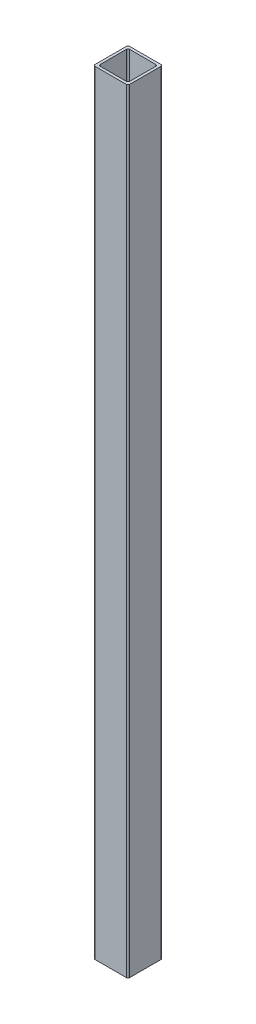
from build123d import *

# Parameters (mm, degrees)
BOSS_EXTRUDE1_DEPTH = 447.59


with BuildPart() as part:
    # Sketch1 → Boss-Extrude1 (new body)
    with BuildSketch(Plane(origin=(0, 0, 0), x_dir=(1, 0, 0), z_dir=(0, 1, 0))):
        with BuildLine():
            Line((-9, -10), (9, -10))
            ThreePointArc((9, -10), (9.707106781, -9.707106781), (10, -9))
            Line((10, -9), (10, 9))
            ThreePointArc((10, 9), (9.707106781, 9.707106781), (9, 10))
            Line((9, 10), (-9, 10))
            ThreePointArc((-9, 10), (-9.707106781, 9.707106781), (-10, 9))
            Line((-10, 9), (-10, -9))
            ThreePointArc((-10, -9), (-9.707106781, -9.707106781), (-9, -10))
        make_face()
        with BuildLine():
            Line((-7.5, -8.5), (7.5, -8.5))
            ThreePointArc((7.5, -8.5), (8.207106781, -8.207106781), (8.5, -7.5))
            Line((8.5, -7.5), (8.5, 7.5))
            ThreePointArc((8.5, 7.5), (8.207106781, 8.207106781), (7.5, 8.5))
            Line((7.5, 8.5), (-7.5, 8.5))
            ThreePointArc((-7.5, 8.5), (-8.207106781, 8.207106781), (-8.5, 7.5))
            Line((-8.5, 7.5), (-8.5, -7.5))
            ThreePointArc((-8.5, -7.5), (-8.207106781, -8.207106781), (-7.5, -8.5))
        make_face(mode=Mode.SUBTRACT)
    extrude(amount=BOSS_EXTRUDE1_DEPTH)


solid = part.part
